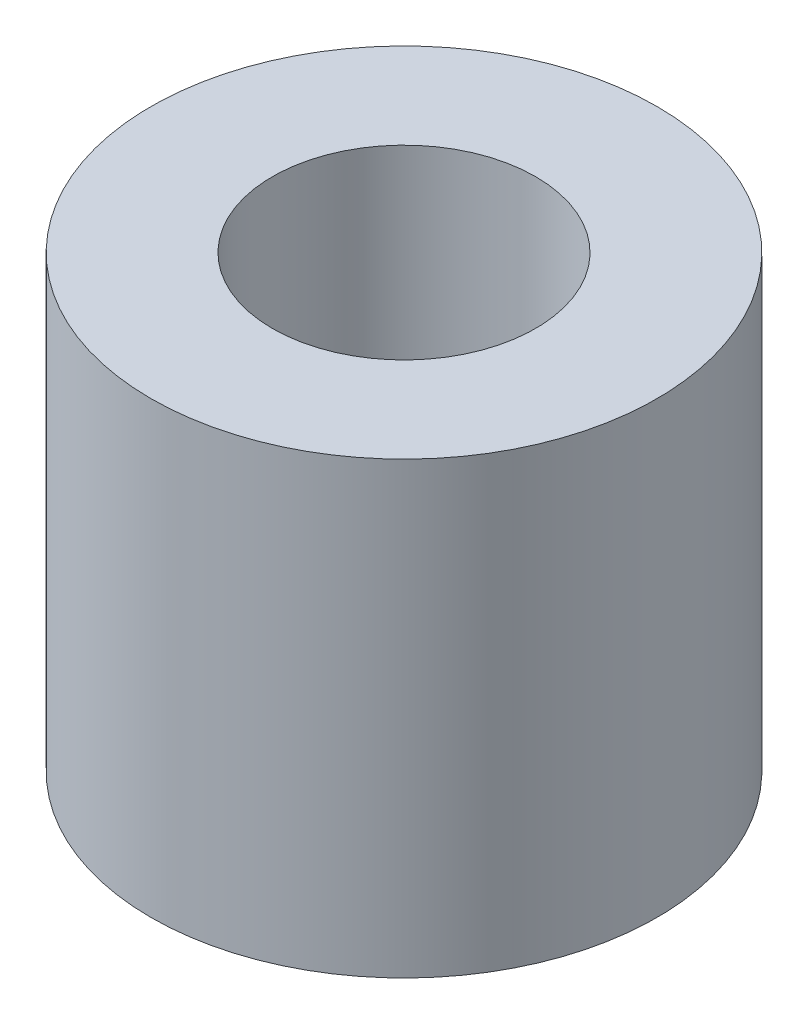
from build123d import *

# Parameters (mm, degrees)
SKETCH_1_R      = 6.25
SKETCH_1_R_2    = 3.25
EXTRUDE_1_DEPTH = 11.1


with BuildPart() as part:
    # 草图1 → 凸台-拉伸1 (new body)
    with BuildSketch(Plane(origin=(0, 0, 0), x_dir=(1, 0, 0), z_dir=(0, 1, 0))):
        with Locations(Location((0, 0, 0), (0, 0, 270))):
            Circle(SKETCH_1_R)
        with Locations(Location((0, 0, 0), (0, 0, 270))):
            Circle(SKETCH_1_R_2, mode=Mode.SUBTRACT)
    extrude(amount=EXTRUDE_1_DEPTH)


solid = part.part
